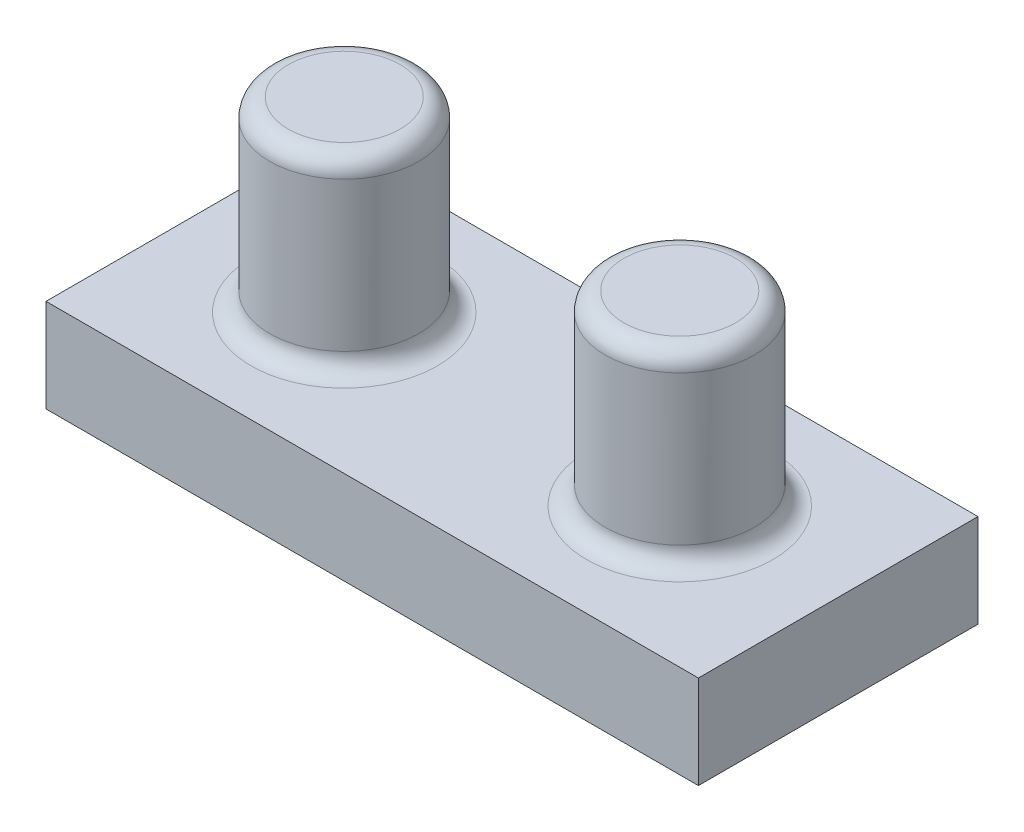
from build123d import *

# Parameters (mm, degrees)
SKETCH1_R             = 4
BOSS_EXTRUDE1_DEPTH   = 10
BOSS_EXTRUDE1_2_DEPTH = 10
SKETCH2_W             = 35
SKETCH2_H             = 15
BOSS_EXTRUDE2_DEPTH   = 5
FILLET1_R             = 1
CUT_EXTRUDE1_DEPTH    = 1


with BuildPart() as part:
    # Sketch1 → Boss-Extrude1 (new body)
    with BuildSketch(Plane(origin=(0, 0, 0), x_dir=(1, 0, 0), z_dir=(0, 1, 0))):
        with Locations(Location((7.086709746, 7.169703638, 0), (0, 0, 270))):
            Circle(SKETCH1_R)
    extrude(amount=BOSS_EXTRUDE1_DEPTH)



with BuildPart() as body_2:
    # Sketch1 → Boss-Extrude1 2 (new body)
    with BuildSketch(Plane(origin=(0, 0, 0), x_dir=(1, 0, 0), z_dir=(0, 1, 0))):
        with Locations(Location((-10.913290254, 7.169703638, 0), (0, 0, 270))):
            Circle(SKETCH1_R)
    extrude(amount=BOSS_EXTRUDE1_2_DEPTH)


with BuildPart() as part_1:
    add(part.part)

    add(body_2.part)  # Boss-Extrude2 merges body 2
    # Sketch2 → Boss-Extrude2 (add)
    with BuildSketch(Plane(origin=(0, 0, 0), x_dir=(-1, 0, 0), z_dir=(0, -1, 0))):
        with Locations((1.913290254, 7.169703638)):
            Rectangle(SKETCH2_W, SKETCH2_H)
    extrude(amount=BOSS_EXTRUDE2_DEPTH)

    # Fillet1
    fillet1_edges = [part_1.edges().sort_by_distance(p)[0] for p in [
        (-10.913290254, 0, -11.169703638),
        (-10.913290254, 10, -11.169703638),
        (7.086709746, 10, -11.169703638),
        (7.086709746, 0, -11.169703638),
    ]]
    fillet(fillet1_edges, radius=FILLET1_R)

    # Sketch3 → Cut-Extrude1 (cut)
    # profile 1 of 4: a face of its own
    with BuildSketch(Plane(origin=(0, 0, -14.669703638), x_dir=(-1, 0, 0), z_dir=(0, 0, -1))):
        with BuildLine():
            Line((4.304418078, -1.853490886), (4.618520642, -1.853490886))
            Line((4.618520642, -1.853490886), (4.618520642, -2.298002104))
            add(Edge.make_bspline(
                [(4.618520642, -2.298002104), (4.646804592, -2.259114502), (4.700999351, -2.184602129), (4.789865004, -2.086411845), (4.878641116, -2.00308369), (4.942574498, -1.959340819), (4.97328827, -1.938326623)],
                knots=[0, 0, 0, 0, 1.134379233, 2.173579362, 3.122582517, 4, 4, 4, 4], degree=3))
            add(Edge.make_bspline(
                [(4.97328827, -1.938326623), (5.015152932, -1.918321258), (5.098150832, -1.878660045), (5.229570057, -1.838426486), (5.364044726, -1.813701385), (5.45485294, -1.810320011), (5.50053186, -1.808619091)],
                knots=[0, 0, 0, 0, 1.014936303, 2.012140481, 3.000054389, 4, 4, 4, 4], degree=3))
            add(Edge.make_bspline(
                [(5.50053186, -1.808619091), (5.531424856, -1.809664382), (5.592560435, -1.811732956), (5.683144526, -1.825192992), (5.771003137, -1.848459165), (5.855617167, -1.880866489), (5.935337846, -1.920113175), (6.008427044, -1.966162883), (6.074051252, -2.017859959), (6.132177303, -2.077538892), (6.184446329, -2.14687549), (6.232525175, -2.227739739), (6.276950388, -2.3219474), (6.301571696, -2.390313941), (6.314534264, -2.426307393)],
                knots=[0, 0, 0, 0, 1.009824226, 1.998387844, 2.986035974, 3.974953746, 4.955485308, 5.885931332, 6.793869504, 7.679848016, 8.601185859, 9.625726857, 10.749998409, 12, 12, 12, 12], degree=3))
            add(Edge.make_bspline(
                [(6.314534264, -2.426307393), (6.328245515, -2.401582973), (6.355227332, -2.352928788), (6.400532969, -2.284070526), (6.448000766, -2.219663734), (6.498035259, -2.15965731), (6.550459846, -2.10434758), (6.605521246, -2.053551678), (6.662906027, -2.007051464), (6.742698267, -1.952728305), (6.846510875, -1.895027123), (6.977398989, -1.844998679), (7.113549161, -1.814082551), (7.205966859, -1.810452278), (7.252635225, -1.808619091)],
                knots=[0, 0, 0, 0, 0.86119277, 1.694706429, 2.50939023, 3.298075842, 4.073795165, 4.829715201, 5.57930267, 6.321991688, 7.768977793, 9.186738141, 10.579381044, 12, 12, 12, 12], degree=3))
            add(Edge.make_bspline(
                [(7.252635225, -1.808619091), (7.295516688, -1.810236312), (7.379439874, -1.81340137), (7.50161714, -1.838254844), (7.615558945, -1.880932491), (7.721036021, -1.939166127), (7.816195835, -2.012345311), (7.898912144, -2.099414148), (7.968682507, -2.199756771), (8.014261147, -2.29414876), (8.045176411, -2.377484093), (8.064237646, -2.448490384), (8.081077341, -2.526641937), (8.095058586, -2.612032199), (8.105277138, -2.704962807), (8.112847854, -2.805281683), (8.117971927, -2.913066794), (8.118333999, -2.987432295), (8.118520642, -3.025766527)],
                knots=[0, 0, 0, 0, 1.209669288, 2.367440248, 3.500751976, 4.631527125, 5.755587489, 6.87532382, 8.007944318, 9.190864318, 9.82315674, 10.514484317, 11.263564316, 12.079023757, 12.955305781, 13.901327259, 14.918167583, 16, 16, 16, 16], degree=3))
            Line((8.118520642, -3.025766527), (8.118520642, -4.411183194))
            Line((8.118520642, -4.411183194), (7.804418078, -4.411183194))
            Line((7.804418078, -4.411183194), (7.804418078, -3.024364284))
            add(Edge.make_bspline(
                [(7.804418078, -3.024364284), (7.804340195, -2.99164371), (7.804190516, -2.928759743), (7.801496884, -2.838507292), (7.79642157, -2.756238934), (7.790486931, -2.682066846), (7.782243122, -2.615818058), (7.77159719, -2.557625639), (7.76031951, -2.507031828), (7.741583519, -2.45094578), (7.711635627, -2.38907557), (7.666018147, -2.322351994), (7.608548041, -2.264271194), (7.542187885, -2.213852877), (7.46663944, -2.172859236), (7.383374717, -2.143583226), (7.292910665, -2.125460348), (7.230287877, -2.123654332), (7.197947725, -2.122721655)],
                knots=[0, 0, 0, 0, 1.253487763, 2.409012846, 3.458416907, 4.410876679, 5.259312806, 6.014470957, 6.676830364, 7.243083969, 8.276244668, 9.299465089, 10.325150304, 11.392391894, 12.482080715, 13.603491619, 14.762376348, 16, 16, 16, 16], degree=3))
            add(Edge.make_bspline(
                [(7.197947725, -2.122721655), (7.158277771, -2.124137813), (7.07987486, -2.126936678), (6.965429373, -2.155510551), (6.855458357, -2.198590802), (6.753243224, -2.261023259), (6.659215433, -2.335831623), (6.578315856, -2.424781219), (6.51148367, -2.525411146), (6.466229694, -2.618557848), (6.437640393, -2.702227292), (6.418763477, -2.775324664), (6.404080085, -2.858406232), (6.390309556, -2.950913722), (6.381321828, -3.053483903), (6.373153456, -3.165642304), (6.369332593, -3.287726263), (6.368798134, -3.372352952), (6.368520642, -3.416291367)],
                knots=[0, 0, 0, 0, 1.090531906, 2.155305635, 3.229839962, 4.33261226, 5.44038871, 6.529323825, 7.629011124, 8.757537029, 9.370236727, 10.061839251, 10.834451254, 11.692844982, 12.636905849, 13.66920014, 14.789842145, 16, 16, 16, 16], degree=3))
            Line((6.368520642, -3.416291367), (6.368520642, -4.411183194))
            Line((6.368520642, -4.411183194), (6.054418078, -4.411183194))
            Line((6.054418078, -4.411183194), (6.054418078, -3.110602264))
            add(Edge.make_bspline(
                [(6.054418078, -3.110602264), (6.054338647, -3.073908946), (6.05418583, -3.003314688), (6.051509512, -2.902081013), (6.046422891, -2.809999933), (6.040542342, -2.727178469), (6.032082164, -2.65376714), (6.022472402, -2.589372382), (6.011123791, -2.534155631), (5.992333906, -2.473592247), (5.963619438, -2.406871324), (5.917431176, -2.335730302), (5.859823596, -2.273462205), (5.79225272, -2.220303456), (5.716247038, -2.176361975), (5.632263637, -2.144702223), (5.541058724, -2.126277934), (5.478181018, -2.123929437), (5.44584436, -2.122721655)],
                knots=[0, 0, 0, 0, 1.320475261, 2.540461679, 3.643808994, 4.639130445, 5.527981419, 6.302341397, 6.981980563, 7.553956391, 8.582137848, 9.585246428, 10.591171744, 11.620968678, 12.668337649, 13.738356861, 14.836885341, 16, 16, 16, 16], degree=3))
            add(Edge.make_bspline(
                [(5.44584436, -2.122721655), (5.407828148, -2.124252115), (5.332063189, -2.127302268), (5.220761219, -2.154756542), (5.113275536, -2.197760617), (5.011320837, -2.257420436), (4.917646689, -2.331319514), (4.835638421, -2.41823441), (4.766695896, -2.517083444), (4.720964081, -2.60924796), (4.691465607, -2.690821235), (4.671870272, -2.760172183), (4.655030646, -2.837172431), (4.642516625, -2.922059542), (4.630436209, -3.014280636), (4.6246059, -3.114295126), (4.618934338, -3.222017214), (4.618661923, -3.296389759), (4.618520642, -3.334961239)],
                knots=[0, 0, 0, 0, 1.098833095, 2.189935336, 3.297829714, 4.440610912, 5.596351641, 6.740013378, 7.886572111, 9.072425424, 9.705826452, 10.395263256, 11.156850408, 11.985370555, 12.878090359, 13.847760091, 14.883794034, 16, 16, 16, 16], degree=3))
            Line((4.618520642, -3.334961239), (4.618520642, -4.411183194))
            Line((4.618520642, -4.411183194), (4.304418078, -4.411183194))
            Line((4.304418078, -4.411183194), (4.304418078, -1.853490886))
        make_face()
    # profile 2 of 4: a face of its own
    with BuildSketch(Plane(origin=(0, 0, -14.669703638), x_dir=(-1, 0, 0), z_dir=(0, 0, -1))):
        with BuildLine():
            Line((-0.227633204, -1.853490886), (0.08646936, -1.853490886))
            Line((0.08646936, -1.853490886), (0.08646936, -2.298002104))
            add(Edge.make_bspline(
                [(0.08646936, -2.298002104), (0.11475331, -2.259114502), (0.168948069, -2.184602129), (0.257813722, -2.086411845), (0.346589834, -2.00308369), (0.410523216, -1.959340819), (0.441236988, -1.938326623)],
                knots=[0, 0, 0, 0, 1.134379233, 2.173579362, 3.122582517, 4, 4, 4, 4], degree=3))
            add(Edge.make_bspline(
                [(0.441236988, -1.938326623), (0.48310165, -1.918321258), (0.56609955, -1.878660045), (0.697518775, -1.838426486), (0.831993444, -1.813701385), (0.922801658, -1.810320011), (0.968480578, -1.808619091)],
                knots=[0, 0, 0, 0, 1.014936303, 2.012140481, 3.000054389, 4, 4, 4, 4], degree=3))
            add(Edge.make_bspline(
                [(0.968480578, -1.808619091), (0.999373574, -1.809664382), (1.060509153, -1.811732956), (1.151093243, -1.825192992), (1.238951855, -1.848459165), (1.323565885, -1.880866489), (1.403286564, -1.920113175), (1.476375762, -1.966162883), (1.54199997, -2.017859959), (1.600126021, -2.077538892), (1.652395047, -2.14687549), (1.700473893, -2.227739739), (1.744899106, -2.3219474), (1.769520414, -2.390313941), (1.782482982, -2.426307393)],
                knots=[0, 0, 0, 0, 1.009824226, 1.998387844, 2.986035974, 3.974953746, 4.955485308, 5.885931332, 6.793869504, 7.679848016, 8.601185859, 9.625726857, 10.749998409, 12, 12, 12, 12], degree=3))
            add(Edge.make_bspline(
                [(1.782482982, -2.426307393), (1.796194233, -2.401582973), (1.82317605, -2.352928788), (1.868481687, -2.284070526), (1.915949484, -2.219663734), (1.965983977, -2.15965731), (2.018408564, -2.10434758), (2.073469964, -2.053551678), (2.130854745, -2.007051464), (2.210646985, -1.952728305), (2.314459593, -1.895027123), (2.445347707, -1.844998679), (2.581497879, -1.814082551), (2.673915577, -1.810452278), (2.720583943, -1.808619091)],
                knots=[0, 0, 0, 0, 0.86119277, 1.694706429, 2.50939023, 3.298075842, 4.073795165, 4.829715201, 5.57930267, 6.321991688, 7.768977793, 9.186738141, 10.579381044, 12, 12, 12, 12], degree=3))
            add(Edge.make_bspline(
                [(2.720583943, -1.808619091), (2.763465406, -1.810236312), (2.847388592, -1.81340137), (2.969565858, -1.838254844), (3.083507663, -1.880932491), (3.188984739, -1.939166127), (3.284144553, -2.012345311), (3.366860862, -2.099414148), (3.436631225, -2.199756771), (3.482209865, -2.29414876), (3.513125129, -2.377484093), (3.532186364, -2.448490384), (3.549026059, -2.526641937), (3.563007304, -2.612032199), (3.573225856, -2.704962807), (3.580796572, -2.805281683), (3.585920645, -2.913066794), (3.586282717, -2.987432295), (3.58646936, -3.025766527)],
                knots=[0, 0, 0, 0, 1.209669288, 2.367440248, 3.500751976, 4.631527125, 5.755587489, 6.87532382, 8.007944318, 9.190864318, 9.82315674, 10.514484317, 11.263564316, 12.079023757, 12.955305781, 13.901327259, 14.918167583, 16, 16, 16, 16], degree=3))
            Line((3.58646936, -3.025766527), (3.58646936, -4.411183194))
            Line((3.58646936, -4.411183194), (3.272366796, -4.411183194))
            Line((3.272366796, -4.411183194), (3.272366796, -3.024364284))
            add(Edge.make_bspline(
                [(3.272366796, -3.024364284), (3.272288913, -2.99164371), (3.272139234, -2.928759743), (3.269445602, -2.838507292), (3.264370288, -2.756238934), (3.258435649, -2.682066846), (3.25019184, -2.615818058), (3.239545908, -2.557625639), (3.228268228, -2.507031828), (3.209532237, -2.45094578), (3.179584345, -2.38907557), (3.133966865, -2.322351994), (3.076496759, -2.264271194), (3.010136603, -2.213852877), (2.934588158, -2.172859236), (2.851323435, -2.143583226), (2.760859383, -2.125460348), (2.698236595, -2.123654332), (2.665896443, -2.122721655)],
                knots=[0, 0, 0, 0, 1.253487763, 2.409012846, 3.458416907, 4.410876679, 5.259312806, 6.014470957, 6.676830364, 7.243083969, 8.276244668, 9.299465089, 10.325150304, 11.392391894, 12.482080715, 13.603491619, 14.762376348, 16, 16, 16, 16], degree=3))
            add(Edge.make_bspline(
                [(2.665896443, -2.122721655), (2.626226489, -2.124137813), (2.547823578, -2.126936678), (2.433378091, -2.155510551), (2.323407075, -2.198590802), (2.221191942, -2.261023259), (2.127164151, -2.335831623), (2.046264573, -2.424781219), (1.979432388, -2.525411146), (1.934178412, -2.618557848), (1.905589111, -2.702227292), (1.886712195, -2.775324664), (1.872028803, -2.858406232), (1.858258274, -2.950913722), (1.849270546, -3.053483903), (1.841102174, -3.165642304), (1.837281311, -3.287726263), (1.836746852, -3.372352952), (1.83646936, -3.416291367)],
                knots=[0, 0, 0, 0, 1.090531906, 2.155305635, 3.229839962, 4.33261226, 5.44038871, 6.529323825, 7.629011124, 8.757537029, 9.370236727, 10.061839251, 10.834451254, 11.692844982, 12.636905849, 13.66920014, 14.789842145, 16, 16, 16, 16], degree=3))
            Line((1.83646936, -3.416291367), (1.83646936, -4.411183194))
            Line((1.83646936, -4.411183194), (1.522366796, -4.411183194))
            Line((1.522366796, -4.411183194), (1.522366796, -3.110602264))
            add(Edge.make_bspline(
                [(1.522366796, -3.110602264), (1.522287365, -3.073908946), (1.522134548, -3.003314688), (1.51945823, -2.902081013), (1.514371609, -2.809999933), (1.50849106, -2.727178469), (1.500030882, -2.65376714), (1.49042112, -2.589372382), (1.479072509, -2.534155631), (1.460282624, -2.473592247), (1.431568156, -2.406871324), (1.385379894, -2.335730302), (1.327772314, -2.273462205), (1.260201438, -2.220303456), (1.184195756, -2.176361975), (1.100212355, -2.144702223), (1.009007442, -2.126277934), (0.946129736, -2.123929437), (0.913793078, -2.122721655)],
                knots=[0, 0, 0, 0, 1.320475261, 2.540461679, 3.643808994, 4.639130445, 5.527981419, 6.302341397, 6.981980563, 7.553956391, 8.582137848, 9.585246428, 10.591171744, 11.620968678, 12.668337649, 13.738356861, 14.836885341, 16, 16, 16, 16], degree=3))
            add(Edge.make_bspline(
                [(0.913793078, -2.122721655), (0.875776866, -2.124252115), (0.800011907, -2.127302268), (0.688709937, -2.154756542), (0.581224254, -2.197760617), (0.479269555, -2.257420436), (0.385595407, -2.331319514), (0.303587139, -2.41823441), (0.234644614, -2.517083444), (0.188912799, -2.60924796), (0.159414325, -2.690821235), (0.13981899, -2.760172183), (0.122979364, -2.837172431), (0.110465342, -2.922059542), (0.098384927, -3.014280636), (0.092554618, -3.114295126), (0.086883056, -3.222017214), (0.086610641, -3.296389759), (0.08646936, -3.334961239)],
                knots=[0, 0, 0, 0, 1.098833095, 2.189935336, 3.297829714, 4.440610912, 5.596351641, 6.740013378, 7.886572111, 9.072425424, 9.705826452, 10.395263256, 11.156850408, 11.985370555, 12.878090359, 13.847760091, 14.883794034, 16, 16, 16, 16], degree=3))
            Line((0.08646936, -3.334961239), (0.08646936, -4.411183194))
            Line((0.08646936, -4.411183194), (-0.227633204, -4.411183194))
            Line((-0.227633204, -4.411183194), (-0.227633204, -1.853490886))
        make_face()
    # profile 3 of 4: a face of its own
    with BuildSketch(Plane(origin=(0, 0, -14.669703638), x_dir=(-1, 0, 0), z_dir=(0, 0, -1))):
        with BuildLine():
            add(Edge.make_bspline(
                [(-2.788831121, -2.461363482), (-2.760182574, -2.476301438), (-2.704308339, -2.505435441), (-2.624731131, -2.552346269), (-2.55200613, -2.601787234), (-2.484115568, -2.651423093), (-2.422252217, -2.703154745), (-2.367107804, -2.757187901), (-2.317320184, -2.812173846), (-2.2738934, -2.869043686), (-2.235696564, -2.927646335), (-2.202684428, -2.988135608), (-2.174467226, -3.050378942), (-2.152104287, -3.115055772), (-2.133682495, -3.181216034), (-2.12100689, -3.249714016), (-2.114189972, -3.320098357), (-2.112901159, -3.367666658), (-2.112248589, -3.391752104)],
                knots=[0, 0, 0, 0, 1.272397273, 2.481599622, 3.635517121, 4.734568067, 5.792894095, 6.808321871, 7.773003508, 8.711915296, 9.623354172, 10.525449501, 11.423591555, 12.311487226, 13.218079475, 14.126165749, 15.051214107, 16, 16, 16, 16], degree=3))
            add(Edge.make_bspline(
                [(-2.112248589, -3.391752104), (-2.113020009, -3.425449837), (-2.11454694, -3.492150294), (-2.127846924, -3.590596405), (-2.147759903, -3.686208187), (-2.176839415, -3.778964678), (-2.214552806, -3.868354051), (-2.261029642, -3.954452825), (-2.313640847, -4.038672134), (-2.355893086, -4.090491535), (-2.377272627, -4.11671204)],
                knots=[0, 0, 0, 0, 1.025265484, 2.029385089, 3.018602448, 3.995076438, 4.983346944, 5.966715145, 6.97116228, 8, 8, 8, 8], degree=3))
            add(Edge.make_bspline(
                [(-2.377272627, -4.11671204), (-2.405109102, -4.147305814), (-2.460438067, -4.208115307), (-2.555220995, -4.287066117), (-2.659242879, -4.353415511), (-2.772101211, -4.407487406), (-2.893494313, -4.449573264), (-3.023396317, -4.479815782), (-3.16206047, -4.497138212), (-3.257365941, -4.499642201), (-3.306259006, -4.500926784)],
                knots=[0, 0, 0, 0, 0.954267603, 1.896743057, 2.838368354, 3.796610408, 4.779680527, 5.799409237, 6.871065594, 8, 8, 8, 8], degree=3))
            add(Edge.make_bspline(
                [(-3.306259006, -4.500926784), (-3.353272394, -4.499774306), (-3.444755673, -4.497531701), (-3.577913551, -4.482337269), (-3.702036621, -4.455709402), (-3.817846589, -4.419264793), (-3.924645282, -4.371854565), (-4.022128383, -4.312846156), (-4.111702356, -4.244614714), (-4.190648829, -4.165200636), (-4.260737273, -4.080142763), (-4.322305326, -3.992391154), (-4.373479405, -3.901937796), (-4.4168065, -3.810131429), (-4.449974523, -3.715685275), (-4.472946733, -3.619085262), (-4.487536047, -3.520500119), (-4.489477182, -3.453968465), (-4.490453717, -3.420498098)],
                knots=[0, 0, 0, 0, 1.256902934, 2.445805442, 3.576955095, 4.645999104, 5.686449165, 6.692658513, 7.68621702, 8.689161843, 9.678783111, 10.630372946, 11.551080876, 12.453998257, 13.34127905, 14.221779781, 15.105423033, 16, 16, 16, 16], degree=3))
            add(Edge.make_bspline(
                [(-4.490453717, -3.420498098), (-4.489875836, -3.395938906), (-4.488733739, -3.347401274), (-4.480828891, -3.275691946), (-4.46812043, -3.205895811), (-4.450860973, -3.137755067), (-4.427469946, -3.071765795), (-4.399227813, -3.007615321), (-4.366295861, -2.945231222), (-4.328214696, -2.884272341), (-4.283912672, -2.825592829), (-4.233749022, -2.768196834), (-4.176721153, -2.712974967), (-4.113463494, -2.659252542), (-4.044698955, -2.606076568), (-3.968641424, -2.55632084), (-3.887307157, -2.506462875), (-3.829501751, -2.476654549), (-3.799848749, -2.461363482)],
                knots=[0, 0, 0, 0, 0.941657376, 1.861047343, 2.762797495, 3.66048619, 4.553285746, 5.444104102, 6.34607688, 7.256116206, 8.197091036, 9.162375105, 10.176350973, 11.237807142, 12.343728897, 13.50695164, 14.721116704, 16, 16, 16, 16], degree=3))
            add(Edge.make_bspline(
                [(-3.799848749, -2.461363482), (-3.840440124, -2.439228714), (-3.919036387, -2.396369606), (-4.023105828, -2.3176228), (-4.112496451, -2.232334985), (-4.184751169, -2.13870519), (-4.241623397, -2.039658316), (-4.280642002, -1.935814064), (-4.307038486, -1.82909795), (-4.309653313, -1.756191754), (-4.310966538, -1.719576623)],
                knots=[0, 0, 0, 0, 1.166880483, 2.259407225, 3.286803203, 4.280235371, 5.237608625, 6.161067461, 7.076446754, 8, 8, 8, 8], degree=3))
            add(Edge.make_bspline(
                [(-4.310966538, -1.719576623), (-4.309331114, -1.682279065), (-4.306043626, -1.607304468), (-4.279460305, -1.495698345), (-4.236140239, -1.38608178), (-4.177219242, -1.278986067), (-4.103832026, -1.178035852), (-4.01578548, -1.087494906), (-3.915182183, -1.008183424), (-3.802524316, -0.941607251), (-3.68128808, -0.887423592), (-3.553372356, -0.850045169), (-3.421005863, -0.825609052), (-3.330908144, -0.822842398), (-3.285225352, -0.821439604)],
                knots=[0, 0, 0, 0, 0.888701115, 1.786444228, 2.72001202, 3.692817113, 4.693886446, 5.687152267, 6.695133018, 7.739871481, 8.800368666, 9.853104506, 10.91144658, 12, 12, 12, 12], degree=3))
            add(Edge.make_bspline(
                [(-3.285225352, -0.821439604), (-3.240721537, -0.822885947), (-3.152965084, -0.825737971), (-3.023970456, -0.849524849), (-2.900545579, -0.889254369), (-2.78311608, -0.943151592), (-2.673784212, -1.009538533), (-2.577181903, -1.089939407), (-2.491849321, -1.180080958), (-2.421264927, -1.281000561), (-2.363102037, -1.387684755), (-2.322601136, -1.499307276), (-2.296649162, -1.613456335), (-2.293375798, -1.690694338), (-2.291735768, -1.729392329)],
                knots=[0, 0, 0, 0, 1.072916533, 2.115669174, 3.151510826, 4.193348718, 5.225979165, 6.227137561, 7.216255879, 8.211077061, 9.189680878, 10.138522389, 11.067357538, 12, 12, 12, 12], degree=3))
            add(Edge.make_bspline(
                [(-2.291735768, -1.729392329), (-2.293170329, -1.767368992), (-2.295987725, -1.841953002), (-2.319687664, -1.950679522), (-2.359600978, -2.052501561), (-2.414095141, -2.148574513), (-2.485120628, -2.237156011), (-2.571729361, -2.319372481), (-2.673230839, -2.395899309), (-2.749491726, -2.439085673), (-2.788831121, -2.461363482)],
                knots=[0, 0, 0, 0, 0.975232327, 1.915300861, 2.843280834, 3.77672583, 4.742871857, 5.749627742, 6.839139064, 8, 8, 8, 8], degree=3))
        make_face()
        with BuildLine():
            add(Edge.make_bspline(
                [(-3.302753397, -1.180413963), (-3.327304202, -1.181065404), (-3.375336314, -1.182339906), (-3.445764985, -1.188998543), (-3.512737352, -1.20195176), (-3.576953153, -1.219190472), (-3.637531965, -1.24247846), (-3.695296519, -1.269873469), (-3.749263709, -1.303179535), (-3.800085012, -1.340540732), (-3.845835787, -1.381633638), (-3.886440338, -1.424447357), (-3.920168453, -1.469822749), (-3.948809562, -1.516631109), (-3.96959108, -1.566261685), (-3.985155383, -1.617192862), (-3.995676775, -1.670068246), (-3.996465165, -1.706204756), (-3.996863974, -1.724484476)],
                knots=[0, 0, 0, 0, 1.203892937, 2.355340988, 3.463153438, 4.544400666, 5.610487187, 6.640501085, 7.674077295, 8.714426146, 9.728707835, 10.68524104, 11.601827946, 12.495867327, 13.368432065, 14.231010473, 15.105153427, 16, 16, 16, 16], degree=3))
            add(Edge.make_bspline(
                [(-3.996863974, -1.724484476), (-3.996176607, -1.742764985), (-3.994818271, -1.778889898), (-3.984313143, -1.832235764), (-3.968656288, -1.884657401), (-3.944005627, -1.934908312), (-3.914439268, -1.984731671), (-3.877947792, -2.032882257), (-3.834458764, -2.079527642), (-3.785431324, -2.124271084), (-3.732019786, -2.166169847), (-3.675435743, -2.202543028), (-3.616389352, -2.232977139), (-3.555487282, -2.258306543), (-3.492108835, -2.277996481), (-3.426642362, -2.291965127), (-3.359076859, -2.300647124), (-3.313296278, -2.301684145), (-3.290133204, -2.302208835)],
                knots=[0, 0, 0, 0, 0.873023192, 1.725219244, 2.590779336, 3.480155217, 4.391973325, 5.357036234, 6.360879153, 7.436073238, 8.526419356, 9.601555421, 10.645666583, 11.697338044, 12.750135903, 13.812665442, 14.89329948, 16, 16, 16, 16], degree=3))
            add(Edge.make_bspline(
                [(-3.290133204, -2.302208835), (-3.2603831, -2.301335968), (-3.201176733, -2.299598855), (-3.113897401, -2.283447681), (-3.029034757, -2.258041763), (-2.947495852, -2.223281797), (-2.871391267, -2.179653937), (-2.803551199, -2.127420919), (-2.744554306, -2.067788822), (-2.695013696, -2.001685986), (-2.656603849, -1.931334398), (-2.626702042, -1.860734105), (-2.609240826, -1.789131874), (-2.606963259, -1.74116491), (-2.605838332, -1.717473258)],
                knots=[0, 0, 0, 0, 1.076279235, 2.141928126, 3.20205304, 4.278698113, 5.344010996, 6.36967002, 7.368914609, 8.37248503, 9.349703398, 10.264243087, 11.142681841, 12, 12, 12, 12], degree=3))
            add(Edge.make_bspline(
                [(-2.605838332, -1.717473258), (-2.60637023, -1.700845222), (-2.607425971, -1.667840954), (-2.616126026, -1.619102589), (-2.630501859, -1.571473005), (-2.64996494, -1.524558735), (-2.675574734, -1.479018003), (-2.705938922, -1.434134914), (-2.742823423, -1.390919151), (-2.784219857, -1.348363602), (-2.831165265, -1.308979579), (-2.883569178, -1.274344868), (-2.941162928, -1.244932512), (-3.003947878, -1.221043757), (-3.071692802, -1.203101407), (-3.144085676, -1.18966506), (-3.221730123, -1.182091948), (-3.275159874, -1.180985423), (-3.302753397, -1.180413963)],
                knots=[0, 0, 0, 0, 0.814439003, 1.616544685, 2.417341072, 3.248991801, 4.09997495, 4.973547432, 5.9003056, 6.880240646, 7.880314356, 8.896779544, 9.951930927, 11.043077905, 12.18215768, 13.381699519, 14.647792085, 16, 16, 16, 16], degree=3))
        make_face(mode=Mode.SUBTRACT)
        with BuildLine():
            add(Edge.make_bspline(
                [(-3.282420865, -2.661183194), (-3.31354665, -2.661736835), (-3.374607847, -2.662822945), (-3.464064775, -2.674912445), (-3.54991794, -2.691741838), (-3.631877877, -2.717272677), (-3.709909973, -2.750469167), (-3.784436656, -2.790403707), (-3.854887786, -2.83760915), (-3.920290512, -2.891485765), (-3.980013841, -2.949545219), (-4.032412141, -3.011007355), (-4.076909662, -3.074729887), (-4.112742913, -3.141522117), (-4.142154645, -3.209969727), (-4.161468522, -3.281777323), (-4.173850234, -3.355564436), (-4.175512865, -3.405724534), (-4.176351153, -3.431014925)],
                knots=[0, 0, 0, 0, 1.140299081, 2.23698856, 3.303958914, 4.344563908, 5.37730929, 6.408454204, 7.439741482, 8.480804886, 9.510774543, 10.48932336, 11.43758569, 12.353841022, 13.263987381, 14.161954604, 15.073269652, 16, 16, 16, 16], degree=3))
            add(Edge.make_bspline(
                [(-4.176351153, -3.431014925), (-4.174987894, -3.462445831), (-4.172283221, -3.524804014), (-4.150826582, -3.616967085), (-4.116391046, -3.70618814), (-4.06836583, -3.791740093), (-4.008898258, -3.871690199), (-3.93577179, -3.941378975), (-3.853530952, -4.003300453), (-3.759393098, -4.053380987), (-3.656564632, -4.093375842), (-3.545072903, -4.120931805), (-3.426517984, -4.139173255), (-3.344658392, -4.141011436), (-3.302753397, -4.141952425)],
                knots=[0, 0, 0, 0, 0.898778495, 1.783155532, 2.693654817, 3.627872908, 4.583023416, 5.533784346, 6.509005473, 7.520592997, 8.575161974, 9.658835044, 10.801527049, 12, 12, 12, 12], degree=3))
            add(Edge.make_bspline(
                [(-3.302753397, -4.141952425), (-3.270003029, -4.141323616), (-3.20619481, -4.140098496), (-3.113108861, -4.129284202), (-3.025264312, -4.112134577), (-2.942831514, -4.087191031), (-2.864887674, -4.056741054), (-2.79275432, -4.017568973), (-2.724575793, -3.97301665), (-2.66371167, -3.920158493), (-2.608278461, -3.863678999), (-2.559945169, -3.803888955), (-2.517987618, -3.742413323), (-2.485056662, -3.677862839), (-2.458730408, -3.611475924), (-2.439806853, -3.542640413), (-2.428130638, -3.47114518), (-2.426949742, -3.422646109), (-2.426351153, -3.3980622)],
                knots=[0, 0, 0, 0, 1.224942928, 2.386581632, 3.501229538, 4.569074225, 5.605009692, 6.626002462, 7.634866581, 8.645888296, 9.63523824, 10.59253846, 11.518950513, 12.414518923, 13.29783783, 14.186679152, 15.080837789, 16, 16, 16, 16], degree=3))
            add(Edge.make_bspline(
                [(-2.426351153, -3.3980622), (-2.427257002, -3.37418486), (-2.429043177, -3.327102915), (-2.440379868, -3.257336388), (-2.460295745, -3.189933574), (-2.487623142, -3.124083568), (-2.524004105, -3.061120618), (-2.566848975, -2.999404446), (-2.618543093, -2.940648002), (-2.676955689, -2.884394906), (-2.74061465, -2.832379169), (-2.808281795, -2.78636473), (-2.879436257, -2.747612614), (-2.953927468, -2.716096119), (-3.031590024, -2.691308649), (-3.112366802, -2.673992654), (-3.196352377, -2.663093051), (-3.253407248, -2.661827005), (-3.282420865, -2.661183194)],
                knots=[0, 0, 0, 0, 0.917430815, 1.809013306, 2.70690318, 3.612392954, 4.541220862, 5.495268465, 6.494511384, 7.542276156, 8.608045339, 9.649016899, 10.681629292, 11.715607085, 12.752076957, 13.808767841, 14.885711793, 16, 16, 16, 16], degree=3))
        make_face(mode=Mode.SUBTRACT)
    # profile 4 of 4: a face of its own
    with BuildSketch(Plane(origin=(0, 0, -14.669703638), x_dir=(-1, 0, 0), z_dir=(0, 0, -1))):
        Polygon((-6.438871185, -0.911183194), (-5.791735768, -0.911183194), (-5.791735768, -4.411183194), (-6.105838332, -4.411183194), (-6.105838332, -1.270157553), (-6.644299871, -1.270157553), align=None)
    extrude(amount=-CUT_EXTRUDE1_DEPTH, mode=Mode.SUBTRACT)


solid = part_1.part
